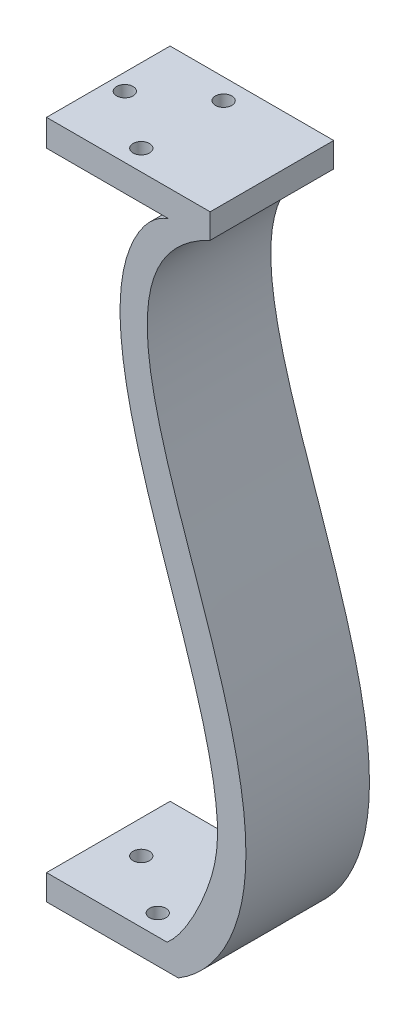
from build123d import *

# Parameters (mm, degrees)
SKETCH1_W               = 50
SKETCH1_H               = 30
BLOCK_DEPTH             = 165
CUT_EXTRUDE1_DEPTH      = 176
CUT_EXTRUDE2_DEPTH      = 176.00000014
CUT_EXTRUDE2_DEPTH_BACK = 176.00000014
CUT_EXTRUDE3_REACH      = 177
SKETCH4_R               = 2
CUT_EXTRUDE10_REACH     = 177
SKETCH6_R               = 2


with BuildPart() as part:
    # Sketch1 → block (new body)
    with BuildSketch(Plane(origin=(0, 0, 0), x_dir=(1, 0, 0), z_dir=(0, 1, 0))):
        with Locations((-25, 15)):
            Rectangle(SKETCH1_W, SKETCH1_H)
    extrude(amount=BLOCK_DEPTH)

    # Sketch2 → Cut-Extrude1 (cut, through all)
    with BuildSketch(Plane.XY):
        with BuildLine():
            Line((-10.266930768, 159), (-10.266930768, 165))
            Line((-10.266930768, 165), (0, 165))
            Line((0, 165), (0, 0))
            Line((0, 0), (-18, 0))
            add(Edge.make_bspline(
                [(-18, 0), (-10.65509128, 4.432537506), (21.096865897, 53.288885799), (-53.333910643, 138.279185217), (-10.266930768, 159)],
                knots=[0, 0, 0, 0, 0.153176096, 1, 1, 1, 1], degree=3))
        make_face()
    extrude(amount=-CUT_EXTRUDE1_DEPTH, mode=Mode.SUBTRACT)

    # Sketch3 → Cut-Extrude2 (cut, two sides: drawn at the far end of the back side and taken through both)
    with BuildSketch(Plane.XY.offset(-CUT_EXTRUDE2_DEPTH_BACK)):
        with BuildLine():
            Line((-50, 6.165602131), (-20.719865449, 6.165602131))
            add(Edge.make_bspline(
                [(-20.719865449, 6.165602131), (-16.417108632, 9.879860863), (-8.594555841, 25.292531348), (-7.124459178, 64.823223932), (-46.284378253, 128.924399551), (-24.281989056, 157.156211749), (-20.35592584, 158.5)],
                knots=[0.052572887, 0.052572887, 0.052572887, 0.052572887, 0.159086781, 0.252212072, 0.902535386, 1, 1, 1, 1], degree=3))
            Line((-20.35592584, 158.5), (-50, 158.5))
            Line((-50, 158.5), (-50, 6.165602131))
        make_face()
    extrude(amount=CUT_EXTRUDE2_DEPTH + CUT_EXTRUDE2_DEPTH_BACK, mode=Mode.SUBTRACT)

    # Sketch4 → Cut-Extrude3 (cut, up to next)
    with BuildSketch(Plane.XZ, mode=Mode.PRIVATE) as cut_extrude3_sk1:
        with Locations(Location((-42, -15, 0), (0, 0, 270))):
            Circle(SKETCH4_R)
    cut_extrude3_tool1 = extrude(cut_extrude3_sk1.sketch, amount=-CUT_EXTRUDE3_REACH, mode=Mode.PRIVATE) & part.part
    # Sketch4 → Cut-Extrude3 (cut, up to next)
    with BuildSketch(Plane.XZ, mode=Mode.PRIVATE) as cut_extrude3_sk2:
        with Locations(Location((-28, -25, 0), (0, 0, 270))):
            Circle(SKETCH4_R)
    cut_extrude3_tool2 = extrude(cut_extrude3_sk2.sketch, amount=-CUT_EXTRUDE3_REACH, mode=Mode.PRIVATE) & part.part
    # Sketch4 → Cut-Extrude3 (cut, up to next)
    with BuildSketch(Plane.XZ, mode=Mode.PRIVATE) as cut_extrude3_sk3:
        with Locations(Location((-28, -5, 0), (0, 0, 180))):
            Circle(SKETCH4_R)
    cut_extrude3_tool3 = extrude(cut_extrude3_sk3.sketch, amount=-CUT_EXTRUDE3_REACH, mode=Mode.PRIVATE) & part.part
    add(cut_extrude3_tool1.solids().sort_by_distance((-42, 0, -15))[0], mode=Mode.SUBTRACT)
    add(cut_extrude3_tool2.solids().sort_by_distance((-28, 0, -25))[0], mode=Mode.SUBTRACT)
    add(cut_extrude3_tool3.solids().sort_by_distance((-28, 0, -5))[0], mode=Mode.SUBTRACT)

    # Sketch6 → Cut-Extrude10 (cut, up to next)
    with BuildSketch(Plane(origin=(0, 165, 0), x_dir=(1, 0, 0), z_dir=(0, 1, 0)), mode=Mode.PRIVATE) as cut_extrude10_sk1:
        with Locations(Location((-46, 15, 0), (0, 0, 270))):
            Circle(SKETCH6_R)
    cut_extrude10_tool1 = extrude(cut_extrude10_sk1.sketch, amount=-CUT_EXTRUDE10_REACH, mode=Mode.PRIVATE) & part.part
    # Sketch6 → Cut-Extrude10 (cut, up to next)
    with BuildSketch(Plane(origin=(0, 165, 0), x_dir=(1, 0, 0), z_dir=(0, 1, 0)), mode=Mode.PRIVATE) as cut_extrude10_sk2:
        with Locations(Location((-32, 25, 0), (0, 0, 270))):
            Circle(SKETCH6_R)
    cut_extrude10_tool2 = extrude(cut_extrude10_sk2.sketch, amount=-CUT_EXTRUDE10_REACH, mode=Mode.PRIVATE) & part.part
    # Sketch6 → Cut-Extrude10 (cut, up to next)
    with BuildSketch(Plane(origin=(0, 165, 0), x_dir=(1, 0, 0), z_dir=(0, 1, 0)), mode=Mode.PRIVATE) as cut_extrude10_sk3:
        with Locations(Location((-32, 5, 0), (0, 0, 270))):
            Circle(SKETCH6_R)
    cut_extrude10_tool3 = extrude(cut_extrude10_sk3.sketch, amount=-CUT_EXTRUDE10_REACH, mode=Mode.PRIVATE) & part.part
    add(cut_extrude10_tool1.solids().sort_by_distance((-46, 165, -15))[0], mode=Mode.SUBTRACT)
    add(cut_extrude10_tool2.solids().sort_by_distance((-32, 165, -25))[0], mode=Mode.SUBTRACT)
    add(cut_extrude10_tool3.solids().sort_by_distance((-32, 165, -5))[0], mode=Mode.SUBTRACT)


solid = part.part
